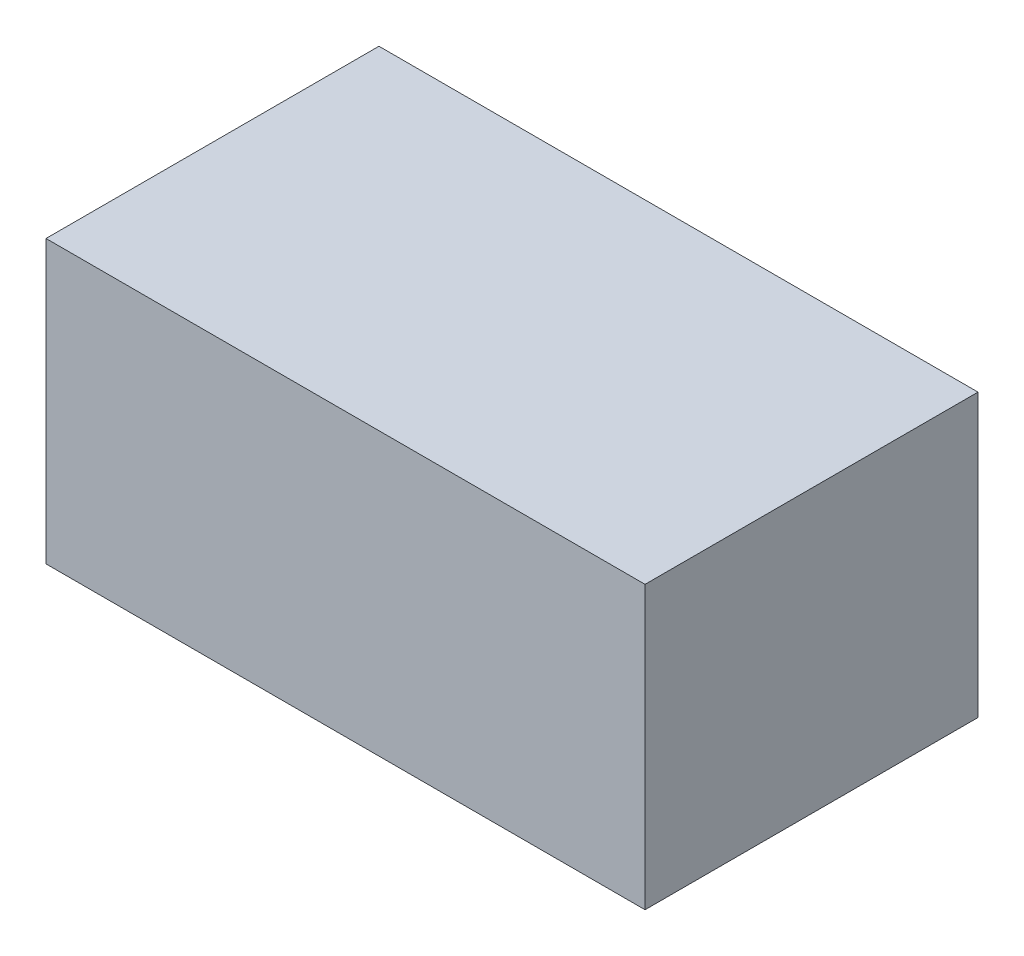
from build123d import *

# Parameters (mm, degrees)
SKETCH_1_W      = 45.7
SKETCH_1_H      = 25.4
EXTRUDE_1_DEPTH = 21.5


with BuildPart() as part:
    # Эскиз1 → Бобышка-Вытянуть1 (new body)
    with BuildSketch(Plane(origin=(0, 0, 0), x_dir=(1, 0, 0), z_dir=(0, 1, 0))):
        Rectangle(SKETCH_1_W, SKETCH_1_H)
    extrude(amount=EXTRUDE_1_DEPTH)


solid = part.part
